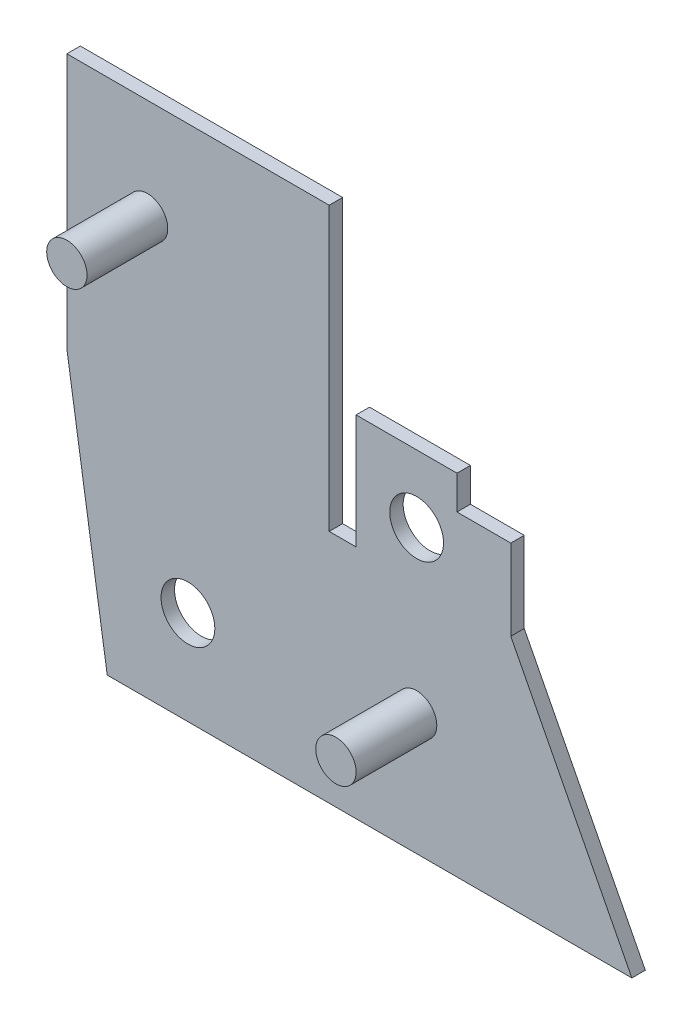
from build123d import *

# Parameters (mm, degrees)
EXTRUDE_1_DEPTH       = 1
SKETCH_2_W            = 11.5
SKETCH_2_H            = 1
EXTRUDE_2_DEPTH       = 8.5
SKETCH_3_W            = 4
SKETCH_3_H            = 2.5
CUT_EXTRUDE_1_DEPTH   = 55.811039034
SKETCH_4_W            = 1.5
SKETCH_4_H            = 6
SKETCH_5_W            = 1.5
SKETCH_5_H            = 6
HOLE_WIZARD_4_0_4_1_D = 4


with BuildPart() as part:
    # Эскиз1 → Бобышка-Вытянуть1 (new body)
    with BuildSketch(Plane.XY.offset(1)):
        Polygon((39, 0), (30, 17.5), (16.5, 17.5), (16.5, 38.5), (-3, 38.5), (-3, 19.5), (0, 0), align=None)
    extrude(amount=-EXTRUDE_1_DEPTH)

    # Эскиз2 → Бобышка-Вытянуть2 (add)
    with BuildSketch(Plane(origin=(0, 17.5, 0), x_dir=(-1, 0, 0), z_dir=(0, 1, 0))):
        with Locations((-24.25, 0.5)):
            Rectangle(SKETCH_2_W, SKETCH_2_H)
    extrude(amount=EXTRUDE_2_DEPTH)

    # Эскиз3 → Вырез-Вытянуть1 (cut, through all)
    with BuildSketch(Plane(origin=(0, 0, 0), x_dir=(-1, 0, 0), z_dir=(0, 0, -1))):
        with Locations((-28, 24.75)):
            Rectangle(SKETCH_3_W, SKETCH_3_H)
    extrude(amount=-CUT_EXTRUDE_1_DEPTH, mode=Mode.SUBTRACT)

    # Эскиз4 → Повернуть1 (revolve)
    with BuildSketch(Plane.XZ.offset(-31), mode=Mode.PRIVATE) as revolve_1_sk:
        with Locations((3.75, 4)):
            Rectangle(SKETCH_4_W, SKETCH_4_H)
    revolve(revolve_1_sk.sketch.rotate(Axis((3, 31, 7), (0, 0, -1)), 180), axis=Axis((3, 31, 7), (0, 0, -1)))

    # Эскиз5 → Повернуть2 (revolve)
    with BuildSketch(Plane.XZ.offset(-9), mode=Mode.PRIVATE) as revolve_2_sk:
        with Locations((23.75, 4)):
            Rectangle(SKETCH_5_W, SKETCH_5_H)
    revolve(revolve_2_sk.sketch.rotate(Axis((23, 9, 7), (0, 0, -1)), 180), axis=Axis((23, 9, 7), (0, 0, -1)))

    # Диаметр отверстия Ø4.0 (4)1 (through all)
    with Locations(Plane.XY.offset(1)):
        with Locations((23, 21), (6, 7)):
            Hole(HOLE_WIZARD_4_0_4_1_D / 2)


solid = part.part
